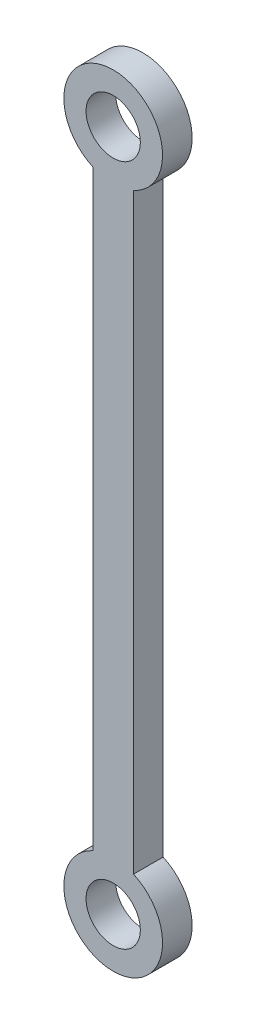
from build123d import *

# Parameters (mm, degrees)
SKETCH3_R           = 2.75
BOSS_EXTRUDE3_DEPTH = 1.5


with BuildPart() as part:
    # Sketch3 → Boss-Extrude3 (new, symmetric)
    with BuildSketch(Plane.XY):
        with BuildLine():
            Line((644.749881263, -1231.581848105), (644.749881263, -1291.581848105))
            ThreePointArc((644.749881263, -1291.581848105), (642.687607751, -1301.136738659), (640.625334239, -1291.581848105))
            Line((640.625334239, -1291.581848105), (640.625334239, -1231.581848105))
            ThreePointArc((640.625334239, -1231.581848105), (642.687607751, -1222.02695755), (644.749881263, -1231.581848105))
        make_face()
        with Locations((642.687607751, -1296.136738659)):
            Circle(SKETCH3_R, mode=Mode.SUBTRACT)
        with Locations((642.687607751, -1227.02695755)):
            Circle(SKETCH3_R, mode=Mode.SUBTRACT)
    extrude(amount=BOSS_EXTRUDE3_DEPTH, both=True)


solid = part.part
